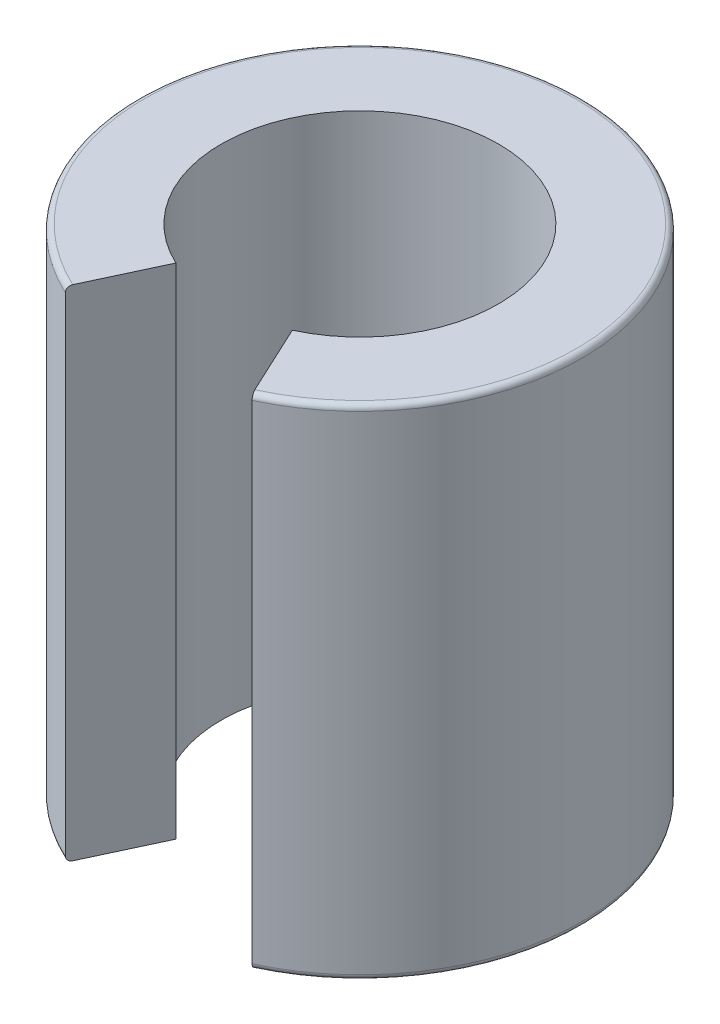
from build123d import *

# Parameters (mm, degrees)
BOSS_EXTRUDE1_DEPTH = 90
FILLET1_R           = 1


with BuildPart() as part:
    # Sketch1 → Boss-Extrude1 (new body)
    with BuildSketch(Plane(origin=(0, 0, 0), x_dir=(1, 0, 0), z_dir=(0, 1, 0))):
        with BuildLine():
            Line((-16.839290437, -36.282754823), (-10.5, -22.688102609))
            ThreePointArc((-10.5, -22.688102609), (0, 25), (10.5, -22.688102609))
            Line((10.5, -22.688102609), (16.839290437, -36.282754823))
            ThreePointArc((16.839290437, -36.282754823), (0, 40), (-16.839290437, -36.282754823))
        make_face()
    extrude(amount=BOSS_EXTRUDE1_DEPTH)

    # Fillet1
    fillet1_edges = [part.edges().sort_by_distance(p)[0] for p in [
        (0, 90, -40),
        (0, 0, -40),
    ]]
    fillet(fillet1_edges, radius=FILLET1_R)


solid = part.part
